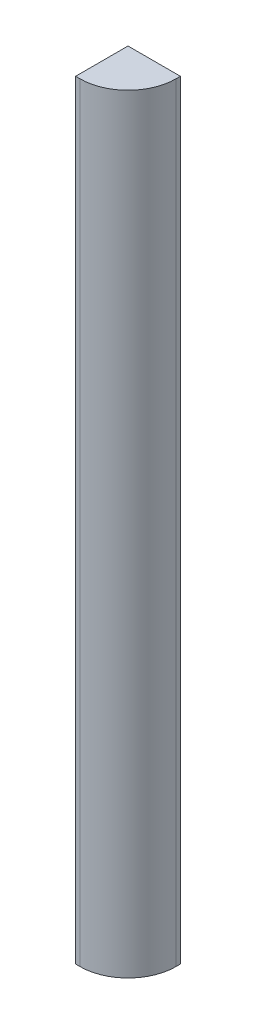
from build123d import *

# Parameters (mm, degrees)
SKETCH1_W           = 6
SKETCH1_H           = 6
BOSS_EXTRUDE1_DEPTH = 87.99
FILLET1_R           = 5.5


with BuildPart() as part:
    # Sketch1 → Boss-Extrude1 (new body)
    with BuildSketch(Plane(origin=(0, 0, 0), x_dir=(1, 0, 0), z_dir=(0, 1, 0))):
        Rectangle(SKETCH1_W, SKETCH1_H)
    extrude(amount=BOSS_EXTRUDE1_DEPTH)

    # Fillet1
    fillet1_edges = [part.edges().sort_by_distance(p)[0] for p in [
        (3, 43.995, 3),
    ]]
    fillet(fillet1_edges, radius=FILLET1_R)


solid = part.part
